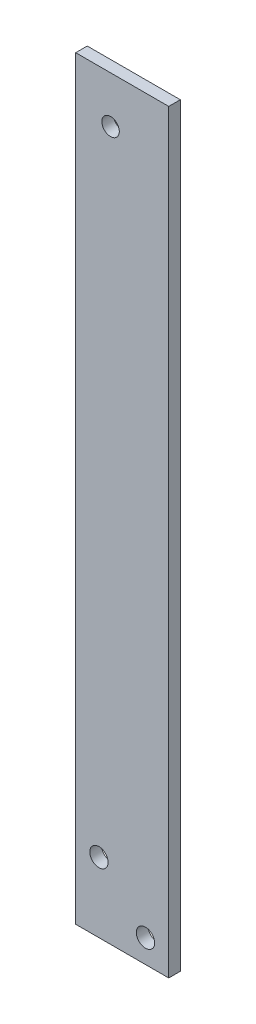
from build123d import *

# Parameters (mm, degrees)
SALIENTE_EXTRUIR1_DEPTH = 6.31
CROQUIS3_R              = 4.7625
CORTAR_EXTRUIR1_DEPTH   = 9.525
CROQUIS4_R              = 5
CORTAR_EXTRUIR2_DEPTH   = 9.525


with BuildPart() as part:
    # Croquis2 → Saliente-Extruir1 (new body)
    with BuildSketch(Plane.XY):
        Polygon((0, 0), (50.8, 0), (50.8, -361.29566061), (50.8, -412.09566061), (0, -412.09566061), align=None)
    extrude(amount=SALIENTE_EXTRUIR1_DEPTH)

    # Croquis3 → Cortar-Extruir1 (cut)
    with BuildSketch(Plane.XY.offset(6.31)):
        with Locations((19.04, -25.4)):
            Circle(CROQUIS3_R)
    extrude(amount=-CORTAR_EXTRUIR1_DEPTH, mode=Mode.SUBTRACT)

    # Croquis4 → Cortar-Extruir2 (cut)
    with BuildSketch(Plane.XY.offset(6.31)):
        with Locations((12.7, -373.995660606)):
            Circle(CROQUIS4_R)
        with Locations((38.1, -399.395660606)):
            Circle(CROQUIS4_R)
    extrude(amount=-CORTAR_EXTRUIR2_DEPTH, mode=Mode.SUBTRACT)


solid = part.part
